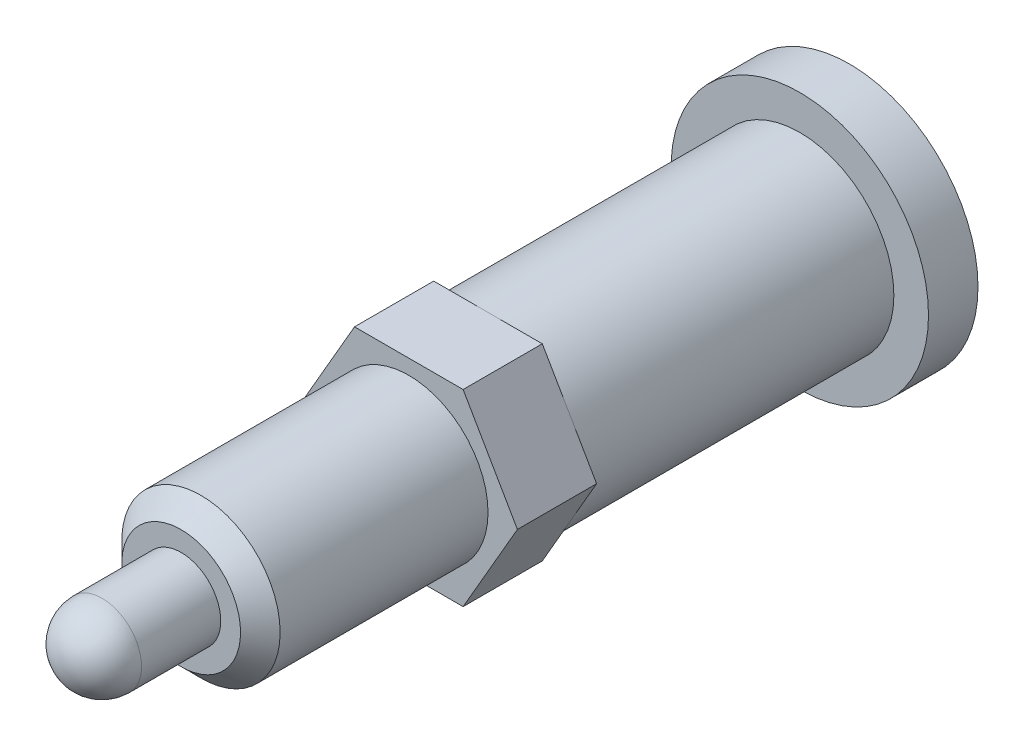
from build123d import *

# Parameters (mm, degrees)
EXTRUDE_1_DEPTH = 8
CHAMFER_1_SIZE  = 2


with BuildPart() as part:
    # 草图1 → 旋转1 (revolve)
    with BuildSketch(Plane(origin=(0, 0, 0), x_dir=(1, 0, 0), z_dir=(0, 1, 0))):
        with BuildLine():
            Line((4, 0), (4, 8))
            Line((4, 8), (8, 8))
            Line((8, 8), (8, 31))
            Line((8, 31), (9.5, 31))
            Line((9.5, 31), (9.5, 70.5))
            Line((9.5, 70.5), (13, 70.5))
            Line((13, 70.5), (13, 75.5))
            ThreePointArc((13, 75.5), (6.519202405, 76.249631268), (0, 76.5))
            Line((0, 76.5), (0, -4))
            ThreePointArc((0, -4), (2.828427125, -2.828427125), (4, 0))
        make_face()
    revolve(axis=Axis((0, 0, 0), (0, 0, -1)))

    # 草图2 → 凸台-拉伸1 (add)
    with BuildSketch(Plane.XY.offset(-31)):
        Polygon((10.969655115, 0), (5.484827557, 9.5), (-5.484827557, 9.5), (-10.969655115, 0), (-5.484827557, -9.5), (5.484827557, -9.5), align=None)
    extrude(amount=-EXTRUDE_1_DEPTH)

    # 倒角1
    chamfer_1_edges = [part.edges().sort_by_distance(p)[0] for p in [
        (-8, 0, -8),
    ]]
    chamfer(chamfer_1_edges, length=CHAMFER_1_SIZE)


solid = part.part
